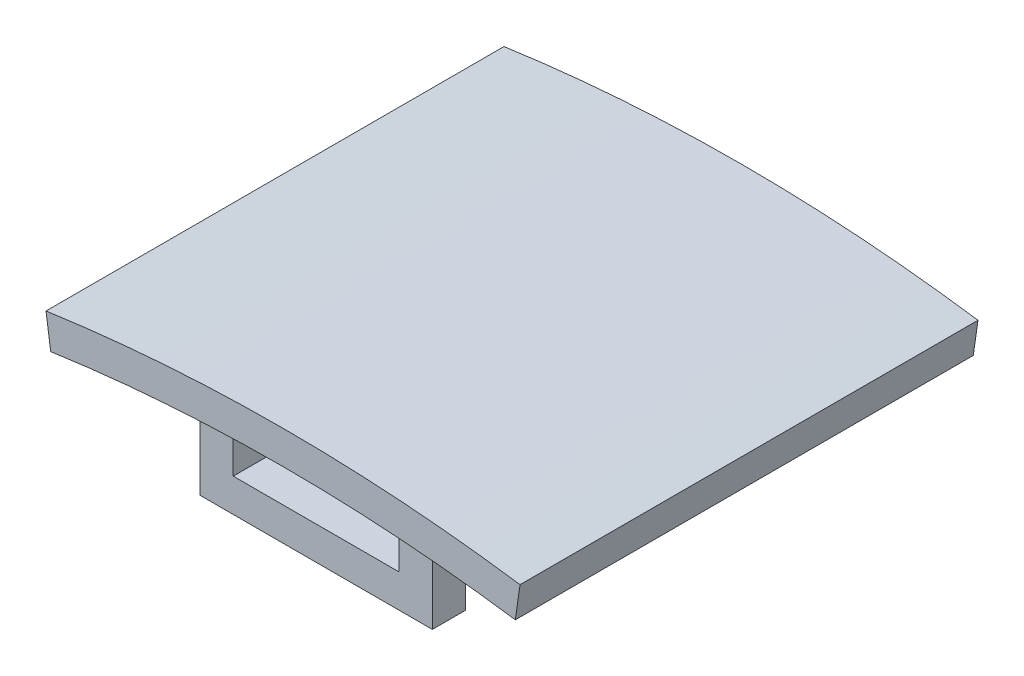
from build123d import *

# Parameters (mm, degrees)
EXTRUDE_1_DEPTH      = 13.8
EXTRUDE_1_DEPTH_BACK = 13.8
EXTRUDE_START        = -2
SKETCH_2_W           = 14
SKETCH_2_H           = 6
SKETCH_2_W_2         = 10
SKETCH_2_H_2         = 2
EXTRUDE_2_DEPTH      = 2
EXTRUDE_3_DEPTH      = 1
EXTRUDE_3_DEPTH_BACK = 3
SKETCH_3_R           = 3
EXTRUDE_4_DEPTH      = 3


with BuildPart() as part:
    # Эскиз1 → Бобышка-Вытянуть1 (new, two sides: drawn at the far end of the back side and taken through both)
    with BuildSketch(Plane.XY.offset(-EXTRUDE_1_DEPTH_BACK)):
        with BuildLine():
            Line((-14, 0), (-14.284263959, 1.979695431))
            ThreePointArc((-14.284263959, 1.979695431), (0, 3), (14.284263959, 1.979695431))
            Line((14.284263959, 1.979695431), (14, 0))
            ThreePointArc((14, 0), (0, 1), (-14, 0))
        make_face()
    extrude(amount=EXTRUDE_1_DEPTH + EXTRUDE_1_DEPTH_BACK)

    # Эскиз2 → Бобышка-Вытянуть2 (add)
    with BuildSketch(Plane.XY.offset(13.8).offset(EXTRUDE_START)):
        with Locations((0, -2)):
            Rectangle(SKETCH_2_W, SKETCH_2_H)
        with Locations((0, -2)):
            Rectangle(SKETCH_2_W_2, SKETCH_2_H_2, mode=Mode.SUBTRACT)
    extrude_2 = extrude(amount=-EXTRUDE_2_DEPTH)

    # Зеркальное отражение1: Бобышка-Вытянуть2 across plane
    add(extrude_2.mirror(Plane.XY))

    # Эскиз3 → Бобышка-Вытянуть3 (add, two sides: drawn at the far end of the back side and taken through both)
    with BuildSketch(Plane(origin=(0, 0, 0), x_dir=(1, 0, 0), z_dir=(0, 1, 0)).offset(-EXTRUDE_3_DEPTH_BACK)):
        with Locations(Location((0, 0, 0), (0, 0, 270))):
            Circle(SKETCH_3_R)
    extrude(amount=EXTRUDE_3_DEPTH + EXTRUDE_3_DEPTH_BACK)

    # Эскиз4 → Бобышка-Вытянуть4 (add)
    with BuildSketch(Plane(origin=(0, -3, 0), x_dir=(-1, 0, 0), z_dir=(0, -1, 0))):
        with BuildLine():
            Line((-1.122795001, -0.994651388), (-2.092247595, -2.15))
            ThreePointArc((-2.092247595, -2.15), (-3, 0), (-2.092247595, 2.15))
            Line((-2.092247595, 2.15), (-1.122795001, 0.994651388))
            ThreePointArc((-1.122795001, 0.994651388), (-1.5, 0), (-1.122795001, -0.994651388))
        make_face()
        with BuildLine():
            Line((1.422790871, 0.4750433), (2.908078416, 0.736939569))
            ThreePointArc((2.908078416, 0.736939569), (1.5, 2.598076211), (-0.81583082, 2.886939569))
            Line((-0.81583082, 2.886939569), (-0.29999587, 1.469694689))
            ThreePointArc((-0.29999587, 1.469694689), (0.75, 1.299038106), (1.422790871, 0.4750433))
        make_face()
        with BuildLine():
            Line((-0.29999587, -1.469694689), (-0.81583082, -2.886939569))
            ThreePointArc((-0.81583082, -2.886939569), (1.5, -2.598076211), (2.908078416, -0.736939569))
            Line((2.908078416, -0.736939569), (1.422790871, -0.4750433))
            ThreePointArc((1.422790871, -0.4750433), (0.75, -1.299038106), (-0.29999587, -1.469694689))
        make_face()
    extrude(amount=EXTRUDE_4_DEPTH)


solid = part.part
